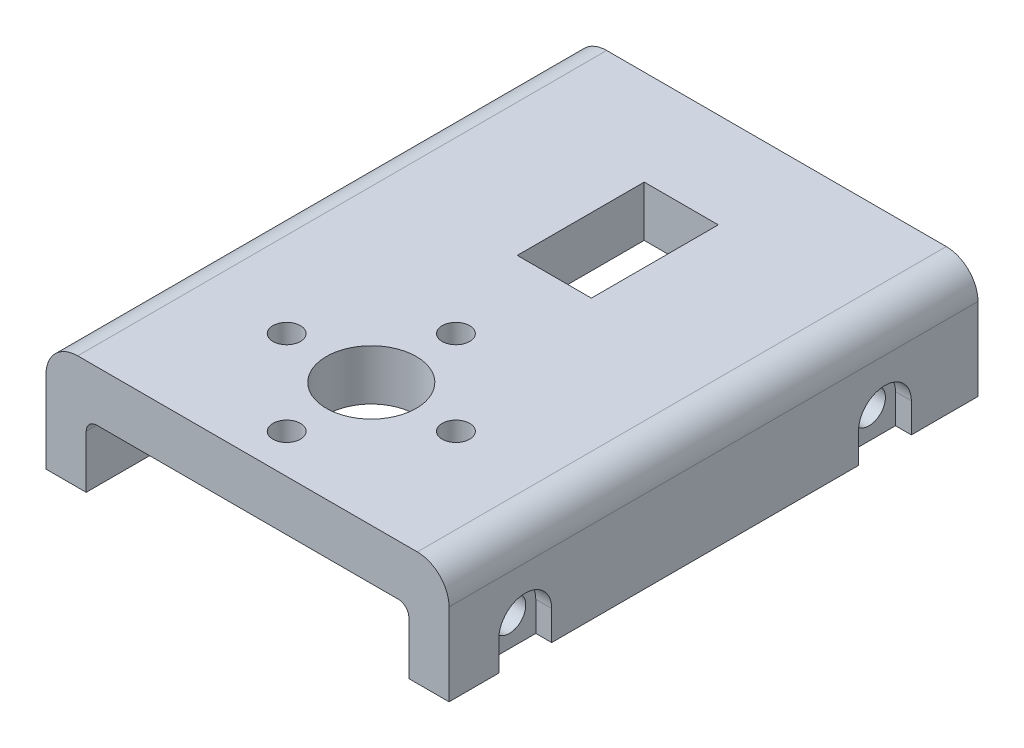
from build123d import *

# Parameters (mm, degrees)
SKETCH1_W              = 50
SKETCH1_H              = 10.775
BOSS_EXTRUDE1_DEPTH    = 19.05
SKETCH2_W              = 30.5
SKETCH2_H              = 6
CUT_EXTRUDE1_DEPTH     = 55.580244824
SKETCH3_R              = 4.25
CUT_EXTRUDE2_DEPTH     = 32.998476526
M2_CLEARANCE_HOLE1_D   = 2.6
M2_5_CLEARANCE_HOLE1_D = 3.1
CUT_EXTRUDE3_DEPTH     = 1.5
CUT_EXTRUDE4_START     = -36.6
CUT_EXTRUDE4_DEPTH     = 1.5
FILLET1_R              = 1
FILLET2_R              = 3
SKETCH9_W              = 7
SKETCH9_H              = 12
CUT_EXTRUDE5_DEPTH     = 34.226542477


with BuildPart() as part:
    # Sketch1 → Boss-Extrude1 (new, symmetric)
    with BuildSketch(Plane(origin=(0, 0, 0), x_dir=(0, 0, -1), z_dir=(1, 0, 0))):
        with Locations((0, -5.3875)):
            Rectangle(SKETCH1_W, SKETCH1_H)
    extrude(amount=BOSS_EXTRUDE1_DEPTH, both=True)

    # Sketch2 → Cut-Extrude1 (cut, through all)
    with BuildSketch(Plane.XY.offset(25)):
        with Locations((0, -7.775)):
            Rectangle(SKETCH2_W, SKETCH2_H)
    extrude(amount=-CUT_EXTRUDE1_DEPTH, mode=Mode.SUBTRACT)

    # Sketch3 → Cut-Extrude2 (cut, through all)
    with BuildSketch(Plane.XZ.offset(4.775)):
        with Locations(Location((0, 13.3, 0), (0, 0, 270))):
            Circle(SKETCH3_R)
    extrude(amount=-CUT_EXTRUDE2_DEPTH, mode=Mode.SUBTRACT)

    # M2 Clearance Hole1 (through all)
    with Locations(Plane(origin=(0, -4.775, 0), x_dir=(-1, 0, 0), z_dir=(0, -1, 0))):
        with Locations((8, -13.3), (0, -21.3), (-8, -13.3), (0, -5.3)):
            Hole(M2_CLEARANCE_HOLE1_D / 2)

    # M2.5 Clearance Hole1 (through all)
    with Locations(Plane.ZY.offset(19.05)):
        with Locations((-16.2, -7.975), (17.8, -7.975)):
            Hole(M2_5_CLEARANCE_HOLE1_D / 2)

    # Sketch8 → Cut-Extrude3 (cut)
    with BuildSketch(Plane(origin=(19.05, 0, 0), x_dir=(0, 0, -1), z_dir=(1, 0, 0))):
        with BuildLine():
            Line((-20.3, -7.975), (-20.3, -10.775))
            Line((-20.3, -10.775), (-15.3, -10.775))
            Line((-15.3, -10.775), (-15.3, -7.975))
            ThreePointArc((-15.3, -7.975), (-17.8, -5.475), (-20.3, -7.975))
        make_face()
        with BuildLine():
            Line((13.7, -7.975), (13.7, -10.775))
            Line((13.7, -10.775), (18.7, -10.775))
            Line((18.7, -10.775), (18.7, -7.975))
            ThreePointArc((18.7, -7.975), (16.2, -5.475), (13.7, -7.975))
        make_face()
    extrude(amount=-CUT_EXTRUDE3_DEPTH, mode=Mode.SUBTRACT)

    # Sketch8<2> → Cut-Extrude4 (cut)
    with BuildSketch(Plane(origin=(19.05, 0, 0), x_dir=(0, 0, -1), z_dir=(1, 0, 0)).offset(CUT_EXTRUDE4_START)):
        with BuildLine():
            Line((-20.3, -7.975), (-20.3, -10.775))
            Line((-20.3, -10.775), (-15.3, -10.775))
            Line((-15.3, -10.775), (-15.3, -7.975))
            ThreePointArc((-15.3, -7.975), (-17.8, -5.475), (-20.3, -7.975))
        make_face()
        with BuildLine():
            Line((13.7, -7.975), (13.7, -10.775))
            Line((13.7, -10.775), (18.7, -10.775))
            Line((18.7, -10.775), (18.7, -7.975))
            ThreePointArc((18.7, -7.975), (16.2, -5.475), (13.7, -7.975))
        make_face()
    extrude(amount=-CUT_EXTRUDE4_DEPTH, mode=Mode.SUBTRACT)

    # Fillet1
    fillet1_edges = [part.edges().sort_by_distance(p)[0] for p in [
        (-15.25, -4.775, 0),
        (15.25, -4.775, 0),
    ]]
    fillet(fillet1_edges, radius=FILLET1_R)

    # Fillet2
    fillet2_edges = [part.edges().sort_by_distance(p)[0] for p in [
        (19.05, 0, 0),
        (-19.05, 0, 0),
    ]]
    fillet(fillet2_edges, radius=FILLET2_R)

    # Sketch9 → Cut-Extrude5 (cut, through all)
    with BuildSketch(Plane(origin=(0, 0, 0), x_dir=(1, 0, 0), z_dir=(0, 1, 0))):
        with Locations((0, 10)):
            Rectangle(SKETCH9_W, SKETCH9_H)
    extrude(amount=-CUT_EXTRUDE5_DEPTH, mode=Mode.SUBTRACT)


solid = part.part
